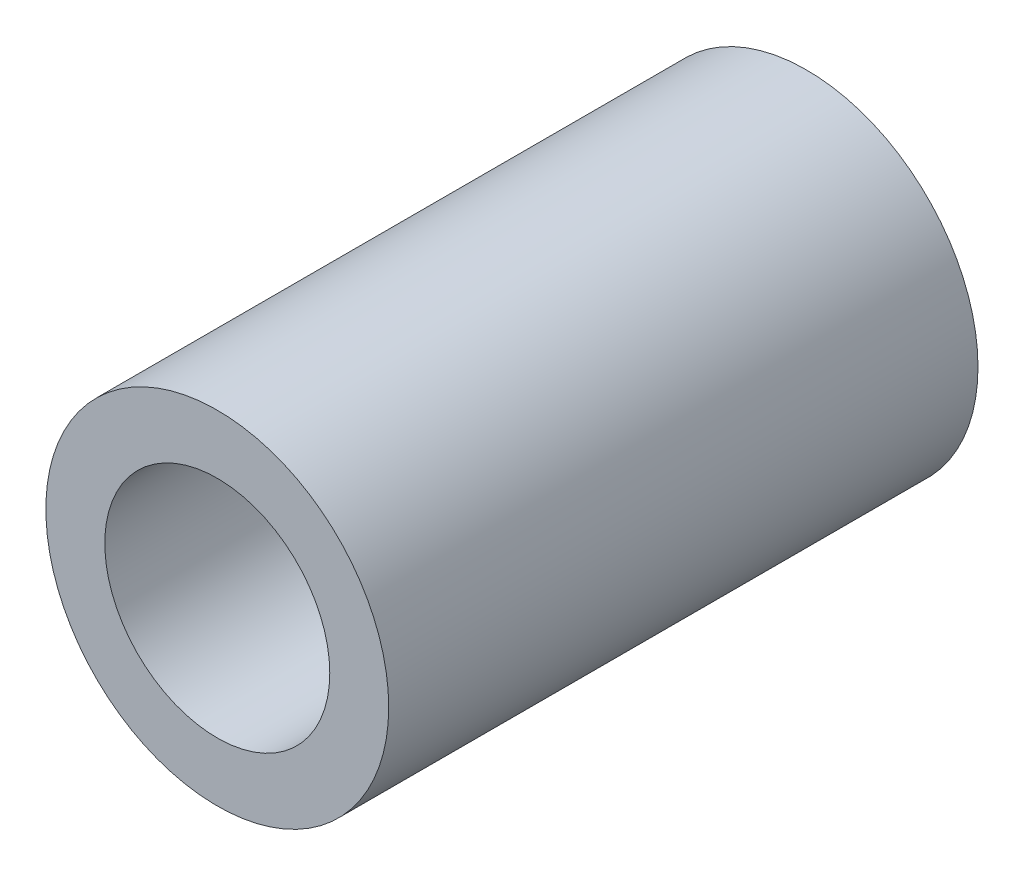
from build123d import *

# Parameters (mm, degrees)
SKETCH1_R           = 8
SKETCH1_R_2         = 5.25
BOSS_EXTRUDE1_DEPTH = 13.75


with BuildPart() as part:
    # Sketch1 → Boss-Extrude1 (new, symmetric)
    with BuildSketch(Plane.XY):
        Circle(SKETCH1_R)
        Circle(SKETCH1_R_2, mode=Mode.SUBTRACT)
    extrude(amount=BOSS_EXTRUDE1_DEPTH, both=True)


solid = part.part
